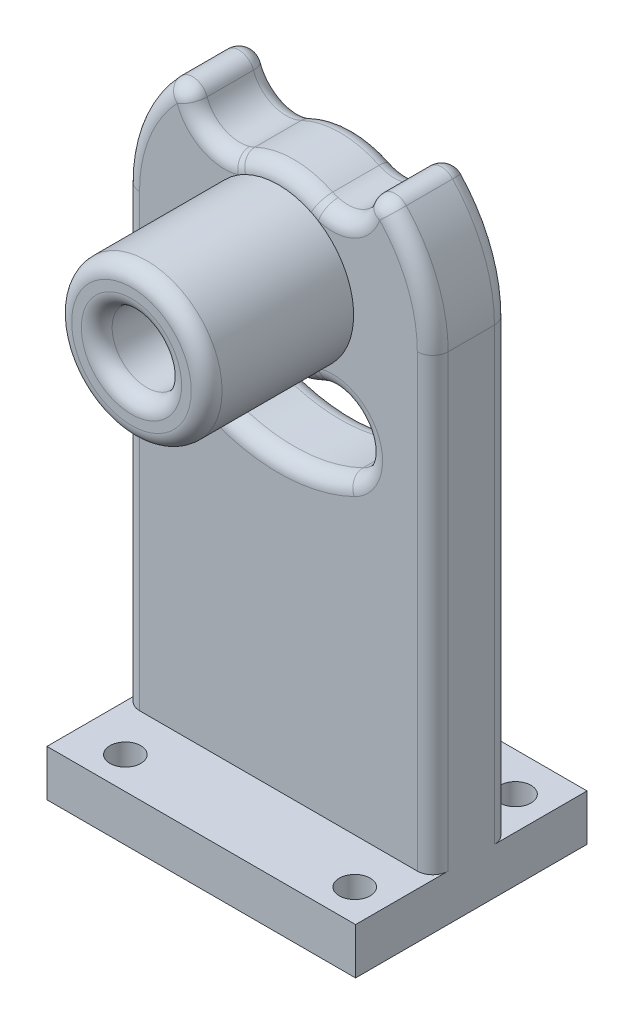
from build123d import *

# Parameters (mm, degrees)
BOSS_EXTRU_1_DEPTH      = 5
BOSS_EXTRU_2_DEPTH      = 5
BOSS_EXTRU_2_DEPTH_BACK = 10
ESQUISSE3_W             = 20
ESQUISSE3_H             = 3
ESQUISSE4_R             = 1
ENL_V_MAT_EXTRU_2_DEPTH = 5
ESQUISSE2_R             = 4.875
BOSS_EXTRU_3_DEPTH      = 9.525
ENL_V_MAT_EXTRU_3_DEPTH = 36.120102111
CONG_1_R                = 1
ESQUISSE6_R             = 2.25
ENL_V_MAT_EXTRU_4_DEPTH = 39.918468614
CONG_2_R                = 1


with BuildPart() as part:
    # Esquisse1 → Boss.-Extru.1 (new body)
    with BuildSketch(Plane.XY):
        with BuildLine():
            Line((-10, -32.146875), (-10, 0))
            ThreePointArc((-10, 0), (0, 10), (10, 0))
            Line((10, 0), (10, -32.146875))
            Line((10, -32.146875), (-10, -32.146875))
        make_face()
    extrude(amount=BOSS_EXTRU_1_DEPTH)

    # Esquisse3 → Boss.-Extru.2 (add, two sides: drawn at the far end of the back side and taken through both)
    with BuildSketch(Plane.XY.offset(5).offset(-BOSS_EXTRU_2_DEPTH_BACK)):
        with Locations((0, -30.646875)):
            Rectangle(ESQUISSE3_W, ESQUISSE3_H)
    extrude(amount=BOSS_EXTRU_2_DEPTH + BOSS_EXTRU_2_DEPTH_BACK)

    # Esquisse4 → Enlèv. mat.-Extru.2 (cut)
    with BuildSketch(Plane(origin=(0, -29.146875, 0), x_dir=(1, 0, 0), z_dir=(0, 1, 0))):
        with Locations(Location((-7, -7.92068908, 0), (0, 0, 270))):
            Circle(ESQUISSE4_R)
        with Locations(Location((7.865355749, -7.92068908, 0), (0, 0, 270))):
            Circle(ESQUISSE4_R)
        with Locations(Location((7.865355749, 2.5, 0), (0, 0, 270))):
            Circle(ESQUISSE4_R)
        with Locations(Location((-7, 2.5, 0), (0, 0, 270))):
            Circle(ESQUISSE4_R)
    extrude(amount=-ENL_V_MAT_EXTRU_2_DEPTH, mode=Mode.SUBTRACT)

    # Esquisse2 → Boss.-Extru.3 (add)
    with BuildSketch(Plane.XY.offset(5)):
        with Locations(Location((0, 0, 0), (0, 0, 180))):
            Circle(ESQUISSE2_R)
    extrude(amount=BOSS_EXTRU_3_DEPTH)

    # Esquisse5 → Enlèv. mat.-Extru.3 (cut, through all)
    with BuildSketch(Plane.XY.offset(5)):
        with BuildLine():
            ThreePointArc((-4.47826087, -9.275515058), (0, -10.3), (4.47826087, -9.275515058))
            ThreePointArc((4.47826087, -9.275515058), (5.526204746, -6.271049442), (2.52173913, -5.223105566))
            ThreePointArc((2.52173913, -5.223105566), (0, -5.8), (-2.52173913, -5.223105566))
            ThreePointArc((-2.52173913, -5.223105566), (-5.526204746, -6.271049442), (-4.47826087, -9.275515058))
        make_face()
    enl_v_mat_extru_3 = extrude(amount=-ENL_V_MAT_EXTRU_3_DEPTH, mode=Mode.SUBTRACT)

    # Symétrie1: Enlèv. mat.-Extru.3 across plane
    add(enl_v_mat_extru_3.mirror(Plane.ZX), mode=Mode.SUBTRACT)

    # Congé1
    cong_1_edges = [part.edges().sort_by_distance(p)[0] for p in [
        (0, -10.3, 5),
        (-5.526204746, -6.271049442, 5),
        (0, -5.8, 0),
        (-5.526204746, -6.271049442, 0),
        (0, -10.3, 0),
        (10, -14.5734375, 0),
        (-10, -14.5734375, 0),
        (10, -14.5734375, 5),
        (-10, -14.5734375, 5),
        (5.526204746, -6.271049442, 5),
        (5.526204746, -6.271049442, 0),
        (-8.785852512, 4.775855488, 0),
        (8.785852512, 4.775855488, 0),
        (-8.785852512, 4.775855488, 5),
        (8.785852512, 4.775855488, 5),
        (4.875, 0, 14.525),
        (-5.155551667, 5.725614582, 0),
        (5.155551667, 5.725614582, 0),
        (5.155551667, 5.725614582, 5),
        (-5.155551667, 5.725614582, 5),
        (0, 5.8, 0),
        (5.438240871, 8.391992387, 2.5),
        (-5.438240871, 8.391992387, 2.5),
    ]]
    fillet(cong_1_edges, radius=CONG_1_R)

    # Esquisse6 → Enlèv. mat.-Extru.4 (cut, through all)
    with BuildSketch(Plane.XY.offset(14.525)):
        Circle(ESQUISSE6_R)
    extrude(amount=-ENL_V_MAT_EXTRU_4_DEPTH, mode=Mode.SUBTRACT)

    # Congé2
    cong_2_edges = [part.edges().sort_by_distance(p)[0] for p in [
        (-2.25, 0, 0),
        (-2.25, 0, 14.525),
    ]]
    fillet(cong_2_edges, radius=CONG_2_R)


solid = part.part
